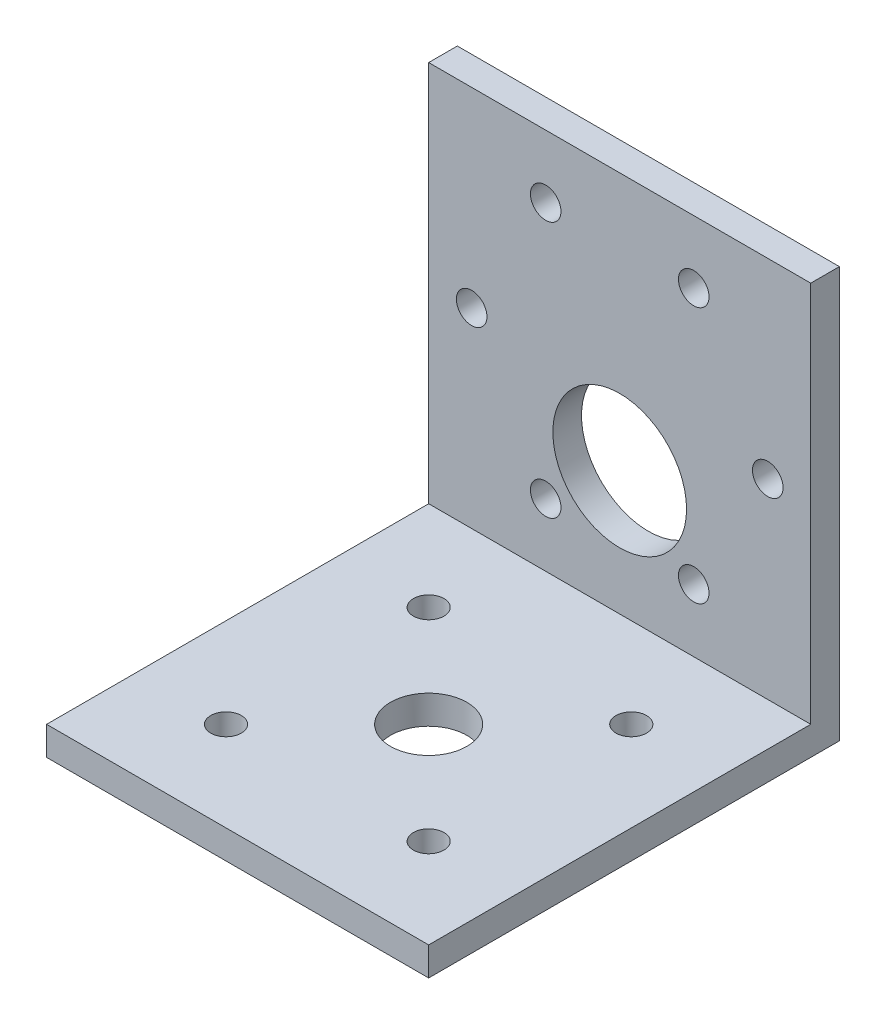
from build123d import *

# Parameters (mm, degrees)
SKETCH2_W               = 40
SKETCH2_H               = 40
SKETCH2_R               = 1.6
SKETCH2_R_2             = 7
BOSS_EXTRUDE1_DEPTH     = 3
SKETCH3_W               = 43
SKETCH3_H               = 3
BOSS_EXTRUDE2_DEPTH     = 40
CUT_EXTRUDE1_DEPTH      = 72.056315694
CUT_EXTRUDE1_DEPTH_BACK = 72.056315694
SKETCH4_R               = 1.6
SKETCH4_R_2             = 4


with BuildPart() as part:
    # Sketch2 → Boss-Extrude1 (new body)
    with BuildSketch(Plane.XY):
        with Locations((20, -20)):
            Rectangle(SKETCH2_W, SKETCH2_H)
        with Locations((4.5, -20)):
            Circle(SKETCH2_R, mode=Mode.SUBTRACT)
        with Locations(Location((35.5, -20, 0), (0, 0, 180))):
            Circle(SKETCH2_R, mode=Mode.SUBTRACT)
        with Locations((12.25, -6.576606241)):
            Circle(SKETCH2_R, mode=Mode.SUBTRACT)
        with Locations(Location((27.75, -6.576606241, 0), (0, 0, 180))):
            Circle(SKETCH2_R, mode=Mode.SUBTRACT)
        with Locations((27.75, -33.423393759)):
            Circle(SKETCH2_R, mode=Mode.SUBTRACT)
        with Locations(Location((12.25, -33.423393759, 0), (0, 0, 180))):
            Circle(SKETCH2_R, mode=Mode.SUBTRACT)
        with Locations((20, -27)):
            Circle(SKETCH2_R_2, mode=Mode.SUBTRACT)
    extrude(amount=BOSS_EXTRUDE1_DEPTH)

    # Sketch3 → Boss-Extrude2 (add)
    with BuildSketch(Plane(origin=(0, 0, 0), x_dir=(0, 0, -1), z_dir=(1, 0, 0))):
        with Locations((-21.5, -41.5)):
            Rectangle(SKETCH3_W, SKETCH3_H)
    extrude(amount=BOSS_EXTRUDE2_DEPTH)

    # Sketch4 → Cut-Extrude1 (cut, two sides: drawn at the far end of the back side and taken through both)
    with BuildSketch(Plane(origin=(0, -40, 0), x_dir=(1, 0, 0), z_dir=(0, 1, 0)).offset(-CUT_EXTRUDE1_DEPTH_BACK)):
        with Locations(Location((9.393398282, -33.606601718, 0), (0, 0, 270))):
            Circle(SKETCH4_R)
        with Locations(Location((20, -23, 0), (0, 0, 270))):
            Circle(SKETCH4_R_2)
        with Locations(Location((9.393398282, -12.393398282, 0), (0, 0, 270))):
            Circle(SKETCH4_R)
        with Locations(Location((30.606601718, -12.393398282, 0), (0, 0, 270))):
            Circle(SKETCH4_R)
        with Locations(Location((30.606601718, -33.606601718, 0), (0, 0, 270))):
            Circle(SKETCH4_R)
    extrude(amount=CUT_EXTRUDE1_DEPTH + CUT_EXTRUDE1_DEPTH_BACK, mode=Mode.SUBTRACT)


solid = part.part
